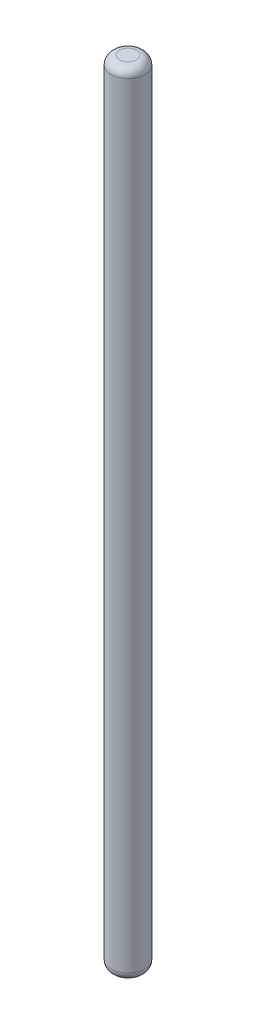
from build123d import *

# Parameters (mm, degrees)
SKETCH1_R           = 1
BOSS_EXTRUDE1_DEPTH = 47
FILLET1_R           = 0.5


with BuildPart() as part:
    # Sketch1 → Boss-Extrude1 (new body)
    with BuildSketch(Plane(origin=(0, 0, 0), x_dir=(1, 0, 0), z_dir=(0, 1, 0))):
        with Locations(Location((0, 0, 0), (0, 0, 270))):
            Circle(SKETCH1_R)
    extrude(amount=BOSS_EXTRUDE1_DEPTH)

    # Fillet1
    fillet1_edges = [part.edges().sort_by_distance(p)[0] for p in [
        (0, 0, -1),
        (0, 47, -1),
    ]]
    fillet(fillet1_edges, radius=FILLET1_R)


solid = part.part
